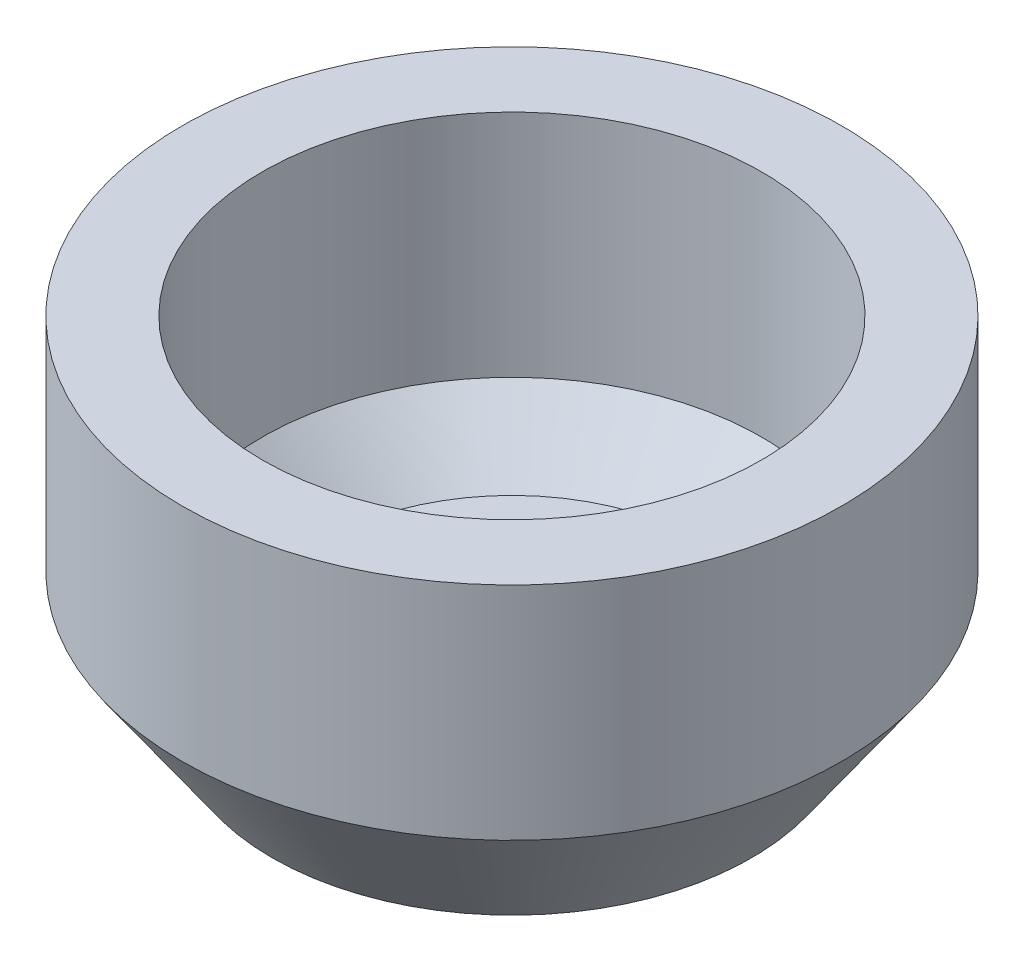
from build123d import *

# Parameters (mm, degrees)
SKETCH1_R           = 3.3
SKETCH1_R_2         = 2.5
BOSS_EXTRUDE1_DEPTH = 3.5
SKETCH1_2_R         = 2.5
BOSS_EXTRUDE2_DEPTH = 0.6


with BuildPart() as part:
    # Sketch1 → Boss-Extrude1 (new body)
    with BuildSketch(Plane(origin=(0, 0, 0), x_dir=(1, 0, 0), z_dir=(0, 1, 0))):
        Circle(SKETCH1_R)
        Circle(SKETCH1_R_2, mode=Mode.SUBTRACT)
    extrude(amount=BOSS_EXTRUDE1_DEPTH)

    # Sketch1<2> → Boss-Extrude2 (add)
    with BuildSketch(Plane(origin=(0, 0, 0), x_dir=(1, 0, 0), z_dir=(0, 1, 0))):
        Circle(SKETCH1_2_R)
    extrude(amount=BOSS_EXTRUDE2_DEPTH)

    # Sketch2 → Revolve1 (revolve)
    with BuildSketch(Plane.XY):
        Polygon((1.9, 0.6), (2.5, 0.6), (2.5, 1.2), align=None)
    revolve(axis=Axis((0, 0, 0), (0, 1, 0)))

    # Sketch3 → Cut-Revolve2 (revolve, cut)
    with BuildSketch(Plane.XY):
        Polygon((3.743125207, 0), (3.743125207, 1.918181588), (2.4, 0), align=None)
    revolve(axis=Axis((0, 0, 0), (0, 1, 0)), mode=Mode.SUBTRACT)


solid = part.part
